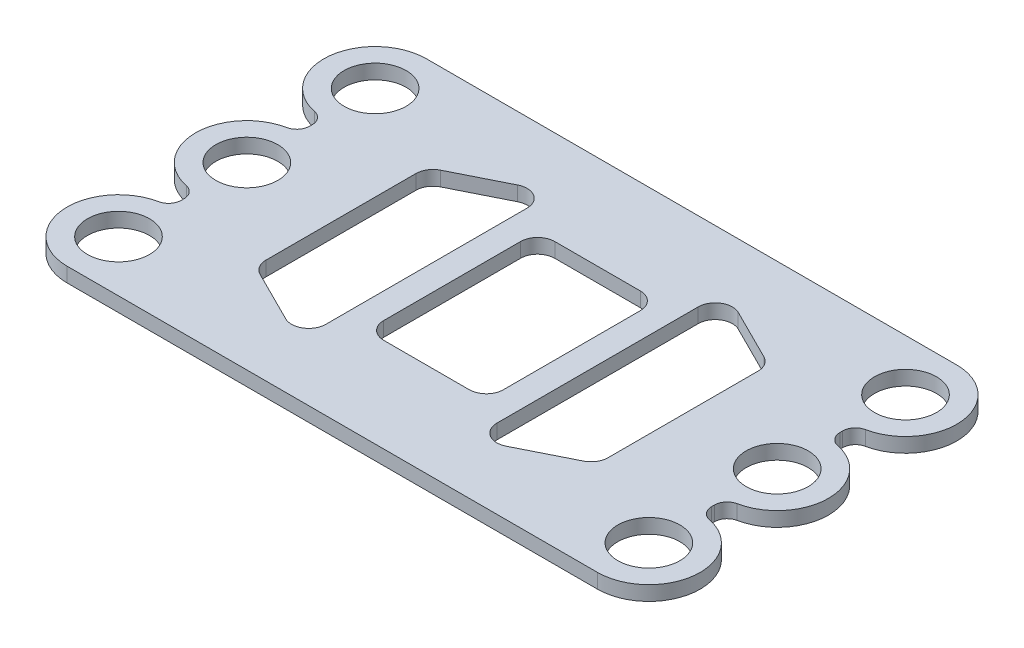
from build123d import *

# Parameters (mm, degrees)
SKETCH1_R           = 6
SKETCH1_R_2         = 3.625
BOSS_EXTRUDE1_DEPTH = 1.7
CUT_EXTRUDE1_REACH  = 44.578
SKETCH2_W           = 10
SKETCH2_H           = 20
SKETCH2_W_2         = 14
FILLET1_R           = 1.5
FILLET2_R           = 2


with BuildPart() as part:
    # Sketch1 → Boss-Extrude1 (new body)
    # profile 1 of 7: a face of its own
    with BuildSketch(Plane(origin=(0, 0, 0), x_dir=(1, 0, 0), z_dir=(0, 1, 0))):
        with BuildLine():
            Line((31, 21), (-31, 21))
            ThreePointArc((-31, 21), (-26.757359313, 19.242640687), (-25, 15))
            ThreePointArc((-25, 15), (-26.757359313, 10.757359313), (-31, 9))
            Line((-31, 9), (-31, 6))
            ThreePointArc((-31, 6), (-26.757359313, 4.242640687), (-25, 0))
            ThreePointArc((-25, 0), (-26.757359313, -4.242640687), (-31, -6))
            Line((-31, -6), (-31, -9))
            ThreePointArc((-31, -9), (-26.757359313, -10.757359313), (-25, -15))
            ThreePointArc((-25, -15), (-26.757359313, -19.242640687), (-31, -21))
            Line((-31, -21), (31, -21))
            ThreePointArc((31, -21), (25, -15), (31, -9))
            Line((31, -9), (31, -6))
            ThreePointArc((31, -6), (25, 0), (31, 6))
            Line((31, 6), (31, 9))
            ThreePointArc((31, 9), (25, 15), (31, 21))
        make_face()
    # profile 2 of 7: a face of its own
    with BuildSketch(Plane(origin=(0, 0, 0), x_dir=(1, 0, 0), z_dir=(0, 1, 0))):
        with Locations((-31, 15)):
            Circle(SKETCH1_R)
        with Locations(Location((-31, 15, 0), (0, 0, 270))):
            Circle(SKETCH1_R_2, mode=Mode.SUBTRACT)
    # profile 3 of 7: a face of its own
    with BuildSketch(Plane(origin=(0, 0, 0), x_dir=(1, 0, 0), z_dir=(0, 1, 0))):
        with Locations((-31, 0)):
            Circle(SKETCH1_R)
        with Locations(Location((-31, 0, 0), (0, 0, 270))):
            Circle(SKETCH1_R_2, mode=Mode.SUBTRACT)
    # profile 4 of 7: a face of its own
    with BuildSketch(Plane(origin=(0, 0, 0), x_dir=(1, 0, 0), z_dir=(0, 1, 0))):
        with Locations((-31, -15)):
            Circle(SKETCH1_R)
        with Locations(Location((-31, -15, 0), (0, 0, 270))):
            Circle(SKETCH1_R_2, mode=Mode.SUBTRACT)
    # profile 5 of 7: a face of its own
    with BuildSketch(Plane(origin=(0, 0, 0), x_dir=(1, 0, 0), z_dir=(0, 1, 0))):
        with Locations((31, -15)):
            Circle(SKETCH1_R)
        with Locations(Location((31, -15, 0), (0, 0, 270))):
            Circle(SKETCH1_R_2, mode=Mode.SUBTRACT)
    # profile 6 of 7: a face of its own
    with BuildSketch(Plane(origin=(0, 0, 0), x_dir=(1, 0, 0), z_dir=(0, 1, 0))):
        with Locations((31, 0)):
            Circle(SKETCH1_R)
        with Locations(Location((31, 0, 0), (0, 0, 270))):
            Circle(SKETCH1_R_2, mode=Mode.SUBTRACT)
    # profile 7 of 7: a face of its own
    with BuildSketch(Plane(origin=(0, 0, 0), x_dir=(1, 0, 0), z_dir=(0, 1, 0))):
        with Locations((31, 15)):
            Circle(SKETCH1_R)
        with Locations(Location((31, 15, 0), (0, 0, 270))):
            Circle(SKETCH1_R_2, mode=Mode.SUBTRACT)
    extrude(amount=BOSS_EXTRUDE1_DEPTH)

    # Sketch2 → Cut-Extrude1 (cut, up to next)
    with BuildSketch(Plane(origin=(0, 1.7, 0), x_dir=(1, 0, 0), z_dir=(0, 1, 0)), mode=Mode.PRIVATE) as cut_extrude1_sk1:
        with Locations((-15, 0)):
            Rectangle(SKETCH2_W, SKETCH2_H)
    cut_extrude1_tool1 = extrude(cut_extrude1_sk1.sketch, amount=-CUT_EXTRUDE1_REACH, mode=Mode.PRIVATE) & part.part
    # Sketch2 → Cut-Extrude1 (cut, up to next)
    with BuildSketch(Plane(origin=(0, 1.7, 0), x_dir=(1, 0, 0), z_dir=(0, 1, 0)), mode=Mode.PRIVATE) as cut_extrude1_sk2:
        Polygon((-10, 10), (-10, 15), (-20, 10), align=None)
    cut_extrude1_tool2 = extrude(cut_extrude1_sk2.sketch, amount=-CUT_EXTRUDE1_REACH, mode=Mode.PRIVATE) & part.part
    # Sketch2 → Cut-Extrude1 (cut, up to next)
    with BuildSketch(Plane(origin=(0, 1.7, 0), x_dir=(1, 0, 0), z_dir=(0, 1, 0)), mode=Mode.PRIVATE) as cut_extrude1_sk3:
        Polygon((-10, -15), (-10, -10), (-20, -10), align=None)
    cut_extrude1_tool3 = extrude(cut_extrude1_sk3.sketch, amount=-CUT_EXTRUDE1_REACH, mode=Mode.PRIVATE) & part.part
    # Sketch2 → Cut-Extrude1 (cut, up to next)
    with BuildSketch(Plane(origin=(0, 1.7, 0), x_dir=(1, 0, 0), z_dir=(0, 1, 0)), mode=Mode.PRIVATE) as cut_extrude1_sk4:
        Polygon((10, -15), (20, -10), (10, -10), align=None)
    cut_extrude1_tool4 = extrude(cut_extrude1_sk4.sketch, amount=-CUT_EXTRUDE1_REACH, mode=Mode.PRIVATE) & part.part
    # Sketch2 → Cut-Extrude1 (cut, up to next)
    with BuildSketch(Plane(origin=(0, 1.7, 0), x_dir=(1, 0, 0), z_dir=(0, 1, 0)), mode=Mode.PRIVATE) as cut_extrude1_sk5:
        with Locations((15, 0)):
            Rectangle(SKETCH2_W, SKETCH2_H)
    cut_extrude1_tool5 = extrude(cut_extrude1_sk5.sketch, amount=-CUT_EXTRUDE1_REACH, mode=Mode.PRIVATE) & part.part
    # Sketch2 → Cut-Extrude1 (cut, up to next)
    with BuildSketch(Plane(origin=(0, 1.7, 0), x_dir=(1, 0, 0), z_dir=(0, 1, 0)), mode=Mode.PRIVATE) as cut_extrude1_sk6:
        Polygon((20, 10), (10, 15), (10, 10), align=None)
    cut_extrude1_tool6 = extrude(cut_extrude1_sk6.sketch, amount=-CUT_EXTRUDE1_REACH, mode=Mode.PRIVATE) & part.part
    # Sketch2 → Cut-Extrude1 (cut, up to next)
    with BuildSketch(Plane(origin=(0, 1.7, 0), x_dir=(1, 0, 0), z_dir=(0, 1, 0)), mode=Mode.PRIVATE) as cut_extrude1_sk7:
        Rectangle(SKETCH2_W_2, SKETCH2_H)
    cut_extrude1_tool7 = extrude(cut_extrude1_sk7.sketch, amount=-CUT_EXTRUDE1_REACH, mode=Mode.PRIVATE) & part.part
    add(cut_extrude1_tool1.solids().sort_by_distance((-15, 1.7, 0))[0], mode=Mode.SUBTRACT)
    add(cut_extrude1_tool2.solids().sort_by_distance((-13.333333, 1.7, -11.666667))[0], mode=Mode.SUBTRACT)
    add(cut_extrude1_tool3.solids().sort_by_distance((-13.333333, 1.7, 11.666667))[0], mode=Mode.SUBTRACT)
    add(cut_extrude1_tool4.solids().sort_by_distance((13.333333, 1.7, 11.666667))[0], mode=Mode.SUBTRACT)
    add(cut_extrude1_tool5.solids().sort_by_distance((15, 1.7, 0))[0], mode=Mode.SUBTRACT)
    add(cut_extrude1_tool6.solids().sort_by_distance((13.333333, 1.7, -11.666667))[0], mode=Mode.SUBTRACT)
    add(cut_extrude1_tool7.solids().sort_by_distance((0, 1.7, 0))[0], mode=Mode.SUBTRACT)

    # Fillet1
    fillet1_edges = [part.edges().sort_by_distance(p)[0] for p in [
        (31, 0.85, -9),
        (31, 0.85, -6),
        (31, 0.85, 6),
        (31, 0.85, 9),
        (-31, 0.85, 9),
        (-31, 0.85, 6),
        (-31, 0.85, -6),
        (-31, 0.85, -9),
    ]]
    fillet(fillet1_edges, radius=FILLET1_R)

    # Fillet2
    fillet2_edges = [part.edges().sort_by_distance(p)[0] for p in [
        (-20, 0.85, 10),
        (-20, 0.85, -10),
        (-10, 0.85, -15),
        (-10, 0.85, 15),
        (20, 0.85, 10),
        (10, 0.85, 15),
        (10, 0.85, -15),
        (20, 0.85, -10),
        (7, 0.85, -10),
        (7, 0.85, 10),
        (-7, 0.85, 10),
        (-7, 0.85, -10),
    ]]
    fillet(fillet2_edges, radius=FILLET2_R)


solid = part.part
